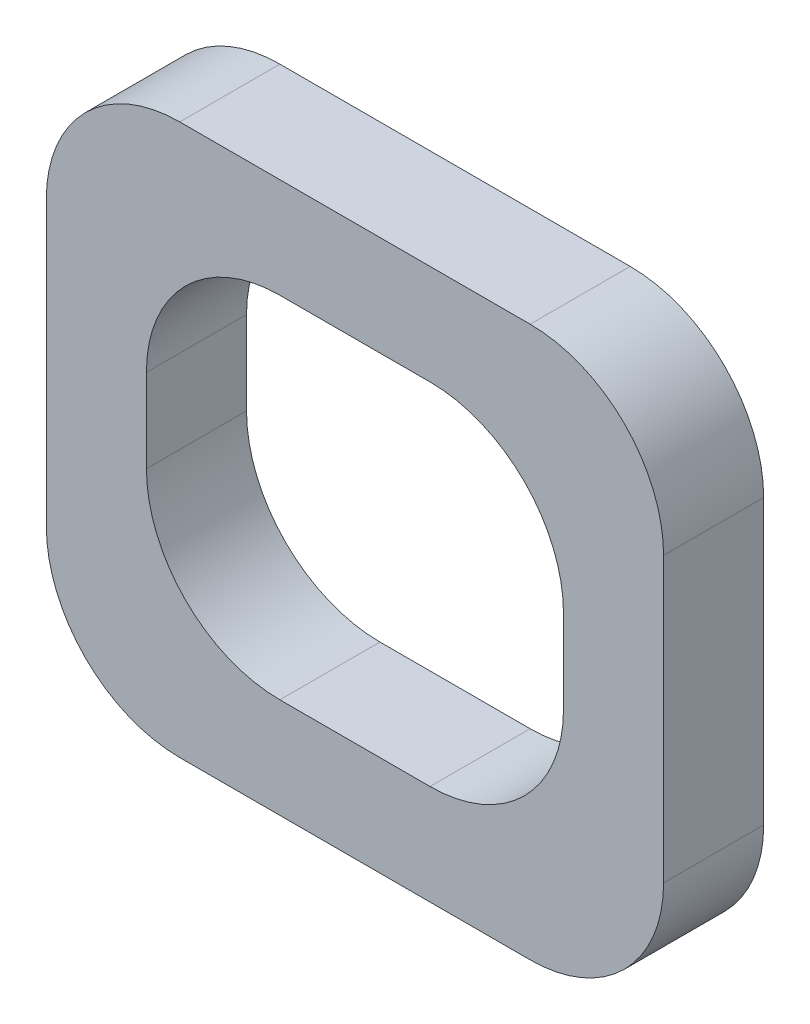
from build123d import *

# Parameters (mm, degrees)
SKETCH1_W           = 18.5
SKETCH1_H           = 16.5
SKETCH1_W_2         = 12.5
SKETCH1_H_2         = 10.5
BOSS_EXTRUDE1_DEPTH = 3
FILLET1_R           = 4


with BuildPart() as part:
    # Sketch1 → Boss-Extrude1 (new body)
    with BuildSketch(Plane.XY):
        Rectangle(SKETCH1_W, SKETCH1_H)
        Rectangle(SKETCH1_W_2, SKETCH1_H_2, mode=Mode.SUBTRACT)
    extrude(amount=BOSS_EXTRUDE1_DEPTH)

    # Fillet1
    fillet1_edges = [part.edges().sort_by_distance(p)[0] for p in [
        (6.25, -5.25, 1.5),
        (6.25, 5.25, 1.5),
        (-6.25, 5.25, 1.5),
        (-6.25, -5.25, 1.5),
        (9.25, -8.25, 1.5),
        (-9.25, -8.25, 1.5),
        (-9.25, 8.25, 1.5),
        (9.25, 8.25, 1.5),
    ]]
    fillet(fillet1_edges, radius=FILLET1_R)


solid = part.part
